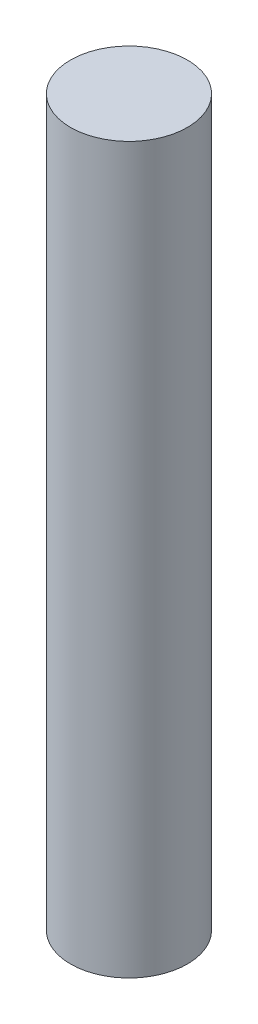
from build123d import *

# Parameters (mm, degrees)
SKETCH1_R           = 2.5
BOSS_EXTRUDE1_DEPTH = 31


with BuildPart() as part:
    # Sketch1 → Boss-Extrude1 (new body)
    with BuildSketch(Plane(origin=(0, 0, 0), x_dir=(1, 0, 0), z_dir=(0, 1, 0))):
        with Locations(Location((0, 0, 0), (0, 0, 270))):
            Circle(SKETCH1_R)
    extrude(amount=BOSS_EXTRUDE1_DEPTH)


solid = part.part
